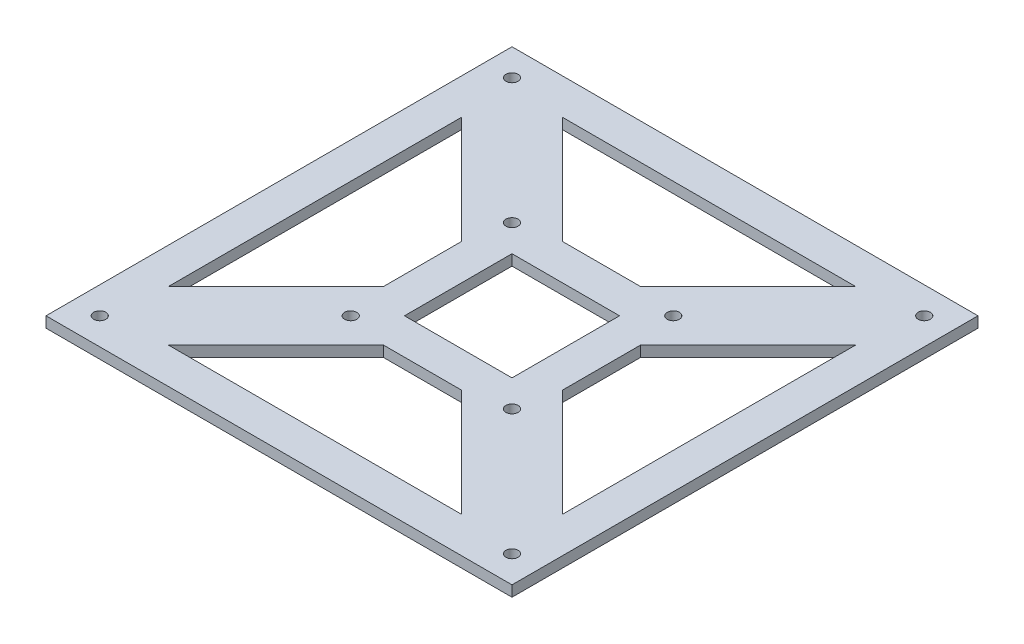
from build123d import *

# Parameters (mm, degrees)
SKETCH1_W           = 130
SKETCH1_H           = 130
SKETCH1_W_2         = 30
SKETCH1_H_2         = 30
BOSS_EXTRUDE1_DEPTH = 3
CUT_EXTRUDE1_DEPTH  = 3
CUT_EXTRUDE2_DEPTH  = 3


with BuildPart() as part:
    # Sketch1 → Boss-Extrude1 (new body)
    with BuildSketch(Plane(origin=(0, 0, 0), x_dir=(1, 0, 0), z_dir=(0, 1, 0))):
        Rectangle(SKETCH1_W, SKETCH1_H)
        Polygon((-55, 40.857864376), (-25, 10.857864376), (-25, -10.857864376), (-55, -40.857864376), align=None, mode=Mode.SUBTRACT)
        Polygon((-40.857864376, -55), (-10.857864376, -25), (10.857864376, -25), (40.857864376, -55), align=None, mode=Mode.SUBTRACT)
        Polygon((55, -40.857864376), (25, -10.857864376), (25, 10.857864376), (55, 40.857864376), align=None, mode=Mode.SUBTRACT)
        Polygon((40.857864376, 55), (10.857864376, 25), (-10.857864376, 25), (-40.857864376, 55), align=None, mode=Mode.SUBTRACT)
        Rectangle(SKETCH1_W_2, SKETCH1_H_2, mode=Mode.SUBTRACT)
    extrude(amount=BOSS_EXTRUDE1_DEPTH)

    # Sketch2 → Cut-Extrude1 (cut)
    with BuildSketch(Plane(origin=(0, 3, 0), x_dir=(1, 0, 0), z_dir=(0, 1, 0))):
        with BuildLine():
            ThreePointArc((-55.8, 57.5), (-58.702081528, 58.702081528), (-57.5, 55.8))
            Line((-57.5, 55.8), (-57.5, 57.5))
            Line((-57.5, 57.5), (-55.8, 57.5))
        make_face()
        with BuildLine():
            Line((-57.5, 57.5), (-57.5, 55.8))
            ThreePointArc((-57.5, 55.8), (-56.297918472, 56.297918472), (-55.8, 57.5))
            Line((-55.8, 57.5), (-57.5, 57.5))
        make_face()
        with BuildLine():
            Line((-57.5, -55.8), (-57.5, -57.5))
            Line((-57.5, -57.5), (-55.8, -57.5))
            ThreePointArc((-55.8, -57.5), (-56.297918472, -56.297918472), (-57.5, -55.8))
        make_face()
        with BuildLine():
            Line((-55.8, -57.5), (-57.5, -57.5))
            Line((-57.5, -57.5), (-57.5, -55.8))
            ThreePointArc((-57.5, -55.8), (-58.702081528, -58.702081528), (-55.8, -57.5))
        make_face()
        with BuildLine():
            ThreePointArc((57.5, -55.8), (56.297918472, -56.297918472), (55.8, -57.5))
            Line((55.8, -57.5), (57.5, -57.5))
            Line((57.5, -57.5), (57.5, -55.8))
        make_face()
        with BuildLine():
            Line((57.5, -57.5), (55.8, -57.5))
            ThreePointArc((55.8, -57.5), (57.5, -59.2), (59.2, -57.5))
            ThreePointArc((59.2, -57.5), (58.702081528, -56.297918472), (57.5, -55.8))
            Line((57.5, -55.8), (57.5, -57.5))
        make_face()
        with BuildLine():
            ThreePointArc((55.8, 57.5), (56.297918472, 56.297918472), (57.5, 55.8))
            Line((57.5, 55.8), (57.5, 57.5))
            Line((57.5, 57.5), (55.8, 57.5))
        make_face()
        with BuildLine():
            Line((57.5, 57.5), (57.5, 55.8))
            ThreePointArc((57.5, 55.8), (58.702081528, 56.297918472), (59.2, 57.5))
            ThreePointArc((59.2, 57.5), (57.5, 59.2), (55.8, 57.5))
            Line((55.8, 57.5), (57.5, 57.5))
        make_face()
    extrude(amount=-CUT_EXTRUDE1_DEPTH, mode=Mode.SUBTRACT)

    # Sketch3 → Cut-Extrude2 (cut)
    with BuildSketch(Plane(origin=(0, 3, 0), x_dir=(1, 0, 0), z_dir=(0, 1, 0))):
        with BuildLine():
            Line((-22.5, -20.8), (-22.5, -22.5))
            Line((-22.5, -22.5), (-20.8, -22.5))
            ThreePointArc((-20.8, -22.5), (-21.297918472, -21.297918472), (-22.5, -20.8))
        make_face()
        with BuildLine():
            Line((-20.8, -22.5), (-22.5, -22.5))
            Line((-22.5, -22.5), (-22.5, -20.8))
            ThreePointArc((-22.5, -20.8), (-23.702081528, -23.702081528), (-20.8, -22.5))
        make_face()
        with BuildLine():
            ThreePointArc((-20.8, 22.5), (-23.702081528, 23.702081528), (-22.5, 20.8))
            Line((-22.5, 20.8), (-22.5, 22.5))
            Line((-22.5, 22.5), (-20.8, 22.5))
        make_face()
        with BuildLine():
            Line((-22.5, 22.5), (-22.5, 20.8))
            ThreePointArc((-22.5, 20.8), (-21.297918472, 21.297918472), (-20.8, 22.5))
            Line((-20.8, 22.5), (-22.5, 22.5))
        make_face()
        with BuildLine():
            ThreePointArc((22.5, -20.8), (21.297918472, -21.297918472), (20.8, -22.5))
            Line((20.8, -22.5), (22.5, -22.5))
            Line((22.5, -22.5), (22.5, -20.8))
        make_face()
        with BuildLine():
            Line((22.5, -22.5), (20.8, -22.5))
            ThreePointArc((20.8, -22.5), (22.5, -24.2), (24.2, -22.5))
            ThreePointArc((24.2, -22.5), (23.702081528, -21.297918472), (22.5, -20.8))
            Line((22.5, -20.8), (22.5, -22.5))
        make_face()
        with BuildLine():
            ThreePointArc((20.8, 22.5), (21.297918472, 21.297918472), (22.5, 20.8))
            Line((22.5, 20.8), (22.5, 22.5))
            Line((22.5, 22.5), (20.8, 22.5))
        make_face()
        with BuildLine():
            Line((22.5, 22.5), (22.5, 20.8))
            ThreePointArc((22.5, 20.8), (23.702081528, 21.297918472), (24.2, 22.5))
            ThreePointArc((24.2, 22.5), (22.5, 24.2), (20.8, 22.5))
            Line((20.8, 22.5), (22.5, 22.5))
        make_face()
    extrude(amount=-CUT_EXTRUDE2_DEPTH, mode=Mode.SUBTRACT)


solid = part.part
